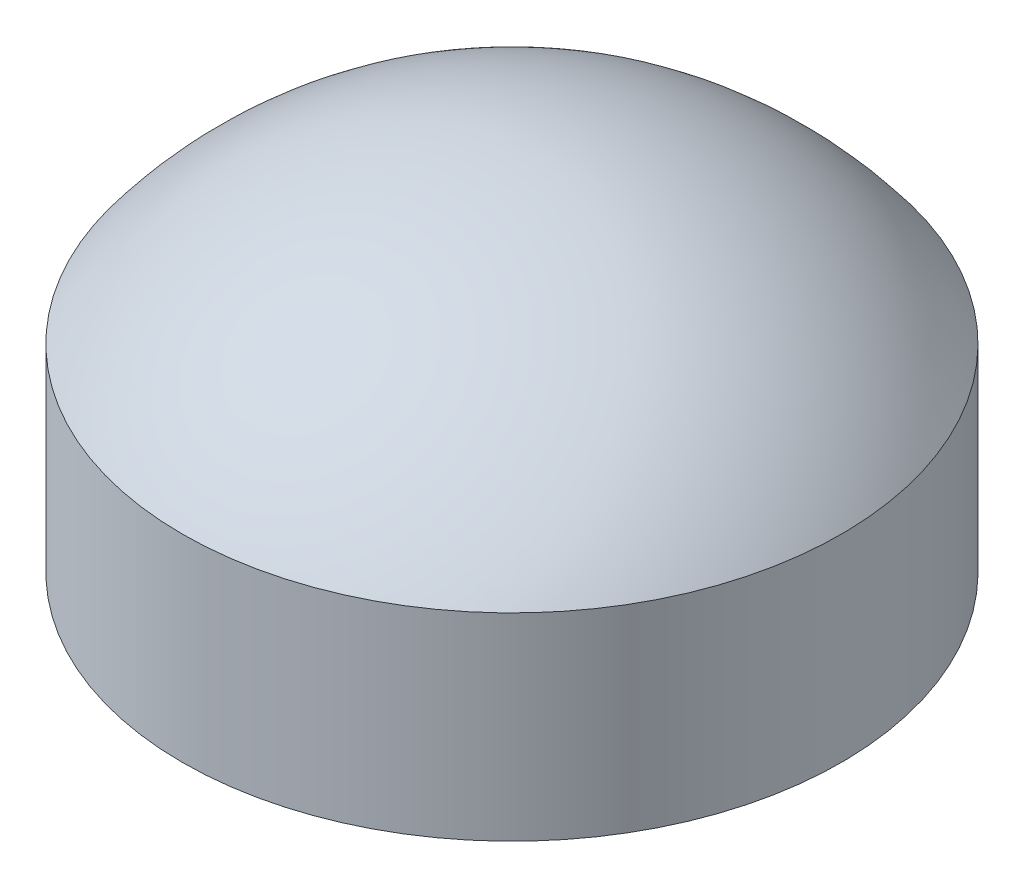
from build123d import *

# Parameters (mm, degrees)
SKETCH1_R           = 20
BOSS_EXTRUDE1_DEPTH = 12
DOME1_FACE_RADIUS   = 20
DOME1_HEIGHT        = 10


with BuildPart() as part:
    # Sketch1 → Boss-Extrude1 (new body)
    with BuildSketch(Plane(origin=(0, 0, 0), x_dir=(1, 0, 0), z_dir=(0, 1, 0))):
        with Locations(Location((0, 0, 0), (0, 0, 270))):
            Circle(SKETCH1_R)
    extrude(amount=BOSS_EXTRUDE1_DEPTH)

    # Dome1: a dome of height H over a round flat face of radius A is a cap of a sphere of radius (A * A + H * H) / (2 * H)
    dome1_r = (DOME1_FACE_RADIUS * DOME1_FACE_RADIUS + DOME1_HEIGHT * DOME1_HEIGHT) / (2 * DOME1_HEIGHT)
    dome1_base = Plane((0, 12, 0), z_dir=(0, 1, 0))
    with Locations(dome1_base.offset(DOME1_HEIGHT - dome1_r)):
        dome1_ball = Sphere(dome1_r, mode=Mode.PRIVATE)
    add(split(dome1_ball, bisect_by=dome1_base, keep=Keep.TOP, mode=Mode.PRIVATE))


solid = part.part
